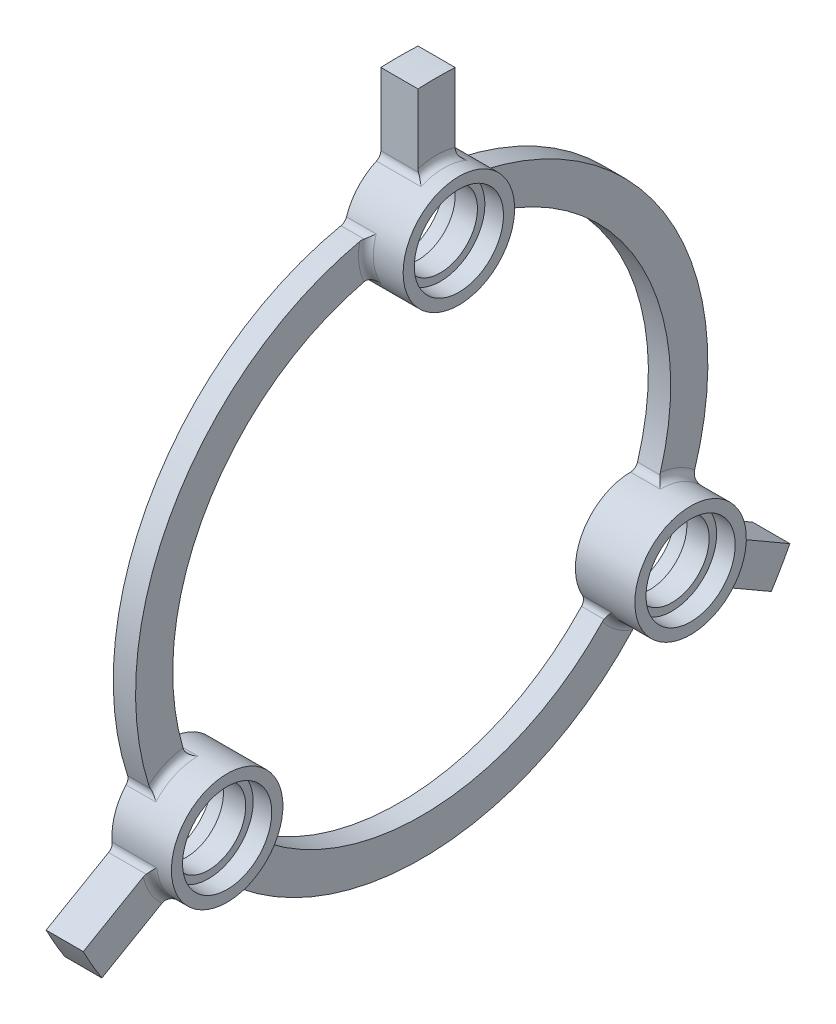
from build123d import *

# Parameters (mm, degrees)
SKETCH_1_R                       = 38.5
SKETCH_1_R_2                     = 33.5
EXTRUDE_1_DEPTH                  = 3
SKETCH_2_R                       = 7.5
EXTRUDE_2_DEPTH                  = 8
SKETCH_4_R                       = 5
CUT_EXTRUDE_1_DEPTH              = 59.638724406
SKETCH_5_R                       = 6
CUT_EXTRUDE_2_DEPTH              = 2.5
CUT_EXTRUDE_START                = -2.5
SKETCH_6_R                       = 6
CUT_EXTRUDE_3_DEPTH              = 2.5
EXTRUDE_3_DEPTH                  = 5
FILLET_1_R                       = 1
PATTERN_CIRCULAR_1_COUNT         = 3
FILLET_1_OF_PATTERN_CIRCULAR_1_R = 1


with BuildPart() as part:
    # Эскиз1 → Бобышка-Вытянуть1 (new body)
    with BuildSketch(Plane(origin=(0, 0, 0), x_dir=(0, 0, -1), z_dir=(1, 0, 0))):
        Circle(SKETCH_1_R)
        Circle(SKETCH_1_R_2, mode=Mode.SUBTRACT)
    extrude(amount=EXTRUDE_1_DEPTH)

    # Эскиз2 → Бобышка-Вытянуть2 (add)
    with BuildSketch(Plane.ZY):
        with Locations((0, 36)):
            Circle(SKETCH_2_R)
    extrude_2 = extrude(amount=-EXTRUDE_2_DEPTH)

    # Эскиз4 → Вырез-Вытянуть1 (cut, through all)
    with BuildSketch(Plane.ZY):
        with Locations((0, 36)):
            Circle(SKETCH_4_R)
    cut_extrude_1 = extrude(amount=-CUT_EXTRUDE_1_DEPTH, mode=Mode.SUBTRACT)

    # Эскиз5 → Вырез-Вытянуть2 (cut)
    with BuildSketch(Plane.ZY):
        with Locations((0, 36)):
            Circle(SKETCH_5_R)
    cut_extrude_2 = extrude(amount=-CUT_EXTRUDE_2_DEPTH, mode=Mode.SUBTRACT)

    # Эскиз6 → Вырез-Вытянуть3 (cut)
    with BuildSketch(Plane(origin=(8, 0, 0), x_dir=(0, 0, -1), z_dir=(1, 0, 0)).offset(CUT_EXTRUDE_START)):
        with Locations(Location((0, 36, 0), (0, 0, 180))):
            Circle(SKETCH_6_R)
    cut_extrude_3 = extrude(amount=CUT_EXTRUDE_3_DEPTH, mode=Mode.SUBTRACT)

    # Эскиз7 → Бобышка-Вытянуть3 (add)
    with BuildSketch(Plane.ZY):
        with BuildLine():
            Line((-2.5, 53.441556864), (-2.5, 43.071067812))
            ThreePointArc((-2.5, 43.071067812), (0, 43.5), (2.5, 43.071067812))
            Line((2.5, 43.071067812), (2.5, 53.441556864))
            ThreePointArc((2.5, 53.441556864), (0, 53.5), (-2.5, 53.441556864))
        make_face()
    extrude_3 = extrude(amount=-EXTRUDE_3_DEPTH)

    # Скругление1
    fillet_1_edges = [part.edges().sort_by_distance(p)[0] for p in [
        (1.5, 32.805555556, 6.785685278),
        (1.5, 32.805555556, -6.785685278),
        (3, 34.363332591, 7.319243116),
        (3, 35.262981133, -7.463699029),
        (1.5, 37.805555556, -7.279420934),
        (1.5, 37.805555556, 7.279420934),
        (5, 43.5, 0),
        (2.5, 43.071067812, 2.5),
        (2.5, 43.071067812, -2.5),
    ]]
    fillet(fillet_1_edges, radius=FILLET_1_R)

    # Круговой массив1: Бобышка-Вытянуть2, Вырез-Вытянуть1, Вырез-Вытянуть2, Вырез-Вытянуть3, Бобышка-Вытянуть3 ×3 about axis
    pattern_circular_1_axis = Axis((0, 0, 0), (1, 0, 0))
    add([extrude_2.rotate(pattern_circular_1_axis, i * 360 / PATTERN_CIRCULAR_1_COUNT) for i in range(1, PATTERN_CIRCULAR_1_COUNT)])
    add([cut_extrude_1.rotate(pattern_circular_1_axis, i * 360 / PATTERN_CIRCULAR_1_COUNT) for i in range(1, PATTERN_CIRCULAR_1_COUNT)], mode=Mode.SUBTRACT)
    add([cut_extrude_2.rotate(pattern_circular_1_axis, i * 360 / PATTERN_CIRCULAR_1_COUNT) for i in range(1, PATTERN_CIRCULAR_1_COUNT)], mode=Mode.SUBTRACT)
    add([cut_extrude_3.rotate(pattern_circular_1_axis, i * 360 / PATTERN_CIRCULAR_1_COUNT) for i in range(1, PATTERN_CIRCULAR_1_COUNT)], mode=Mode.SUBTRACT)
    add([extrude_3.rotate(pattern_circular_1_axis, i * 360 / PATTERN_CIRCULAR_1_COUNT) for i in range(1, PATTERN_CIRCULAR_1_COUNT)])

    # Скругление1 of Круговой массив1
    fillet_1_of_pattern_circular_1_edges = [part.edges().sort_by_distance(p)[0] for p in [
        (1.5, -22.279353611, 25.017601857),
        (1.5, -10.526201945, 31.803287135),
        (3, -23.52031677, 26.099897424),
        (3, -11.167737601, 34.270486988),
        (1.5, -12.598614324, 36.380281982),
        (1.5, -25.206941232, 29.100861048),
        (5, -21.75, 37.672105065),
        (2.5, -23.700597415, 36.050638893),
        (2.5, -19.370470396, 38.550638893),
        (1.5, -10.526201945, -31.803287135),
        (1.5, -22.279353611, -25.017601857),
        (3, -10.84301582, -33.419140541),
        (3, -24.095243531, -26.80678796),
        (1.5, -25.206941232, -29.100861048),
        (1.5, -12.598614324, -36.380281982),
        (5, -21.75, -37.672105065),
        (2.5, -19.370470396, -38.550638893),
        (2.5, -23.700597415, -36.050638893),
    ]]
    fillet(fillet_1_of_pattern_circular_1_edges, radius=FILLET_1_OF_PATTERN_CIRCULAR_1_R)


solid = part.part
